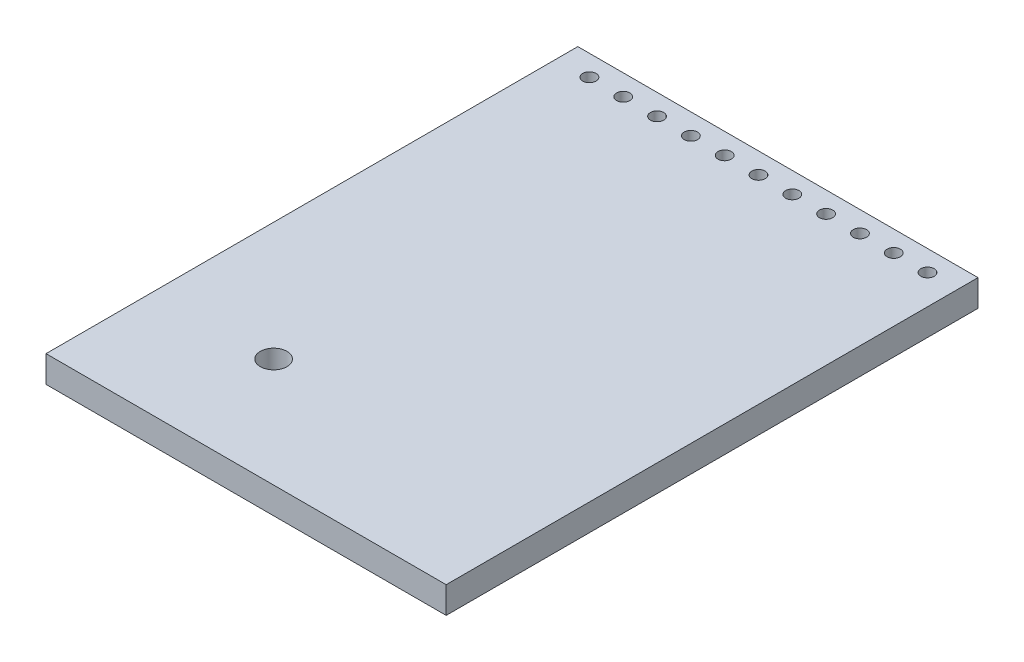
from build123d import *

# Parameters (mm, degrees)
SKETCH1_W           = 30.06
SKETCH1_H           = 2
BOSS_EXTRUDE1_DEPTH = 39.95
SKETCH2_R           = 1
CUT_EXTRUDE1_DEPTH  = 39.95
SKETCH3_R           = 0.5
CUT_EXTRUDE2_DEPTH  = 4.5
LPATTERN1_COUNT     = 11
LPATTERN1_PITCH     = 2.54
SKETCH4_W           = 1.3
SKETCH4_H           = 2
BOSS_EXTRUDE2_DEPTH = 0.2
SKETCH5_W           = 1
SKETCH5_H           = 1
BOSS_EXTRUDE3_DEPTH = 0.2


with BuildPart() as part:
    # Sketch1 → Boss-Extrude1 (new body)
    with BuildSketch(Plane.XY):
        with Locations((15.03, 1)):
            Rectangle(SKETCH1_W, SKETCH1_H)
    extrude(amount=BOSS_EXTRUDE1_DEPTH)

    # Sketch2 → Cut-Extrude1 (cut)
    with BuildSketch(Plane(origin=(0, 2, 0), x_dir=(1, 0, 0), z_dir=(0, 1, 0))):
        with Locations(Location((8.9, -31.75, 0), (0, 0, 270))):
            Circle(SKETCH2_R)
    extrude(amount=-CUT_EXTRUDE1_DEPTH, mode=Mode.SUBTRACT)

    # Sketch3 → Cut-Extrude2 (cut)
    with BuildSketch(Plane(origin=(0, 2, 0), x_dir=(1, 0, 0), z_dir=(0, 1, 0))):
        with Locations(Location((27.83, -1.56, 0), (0, 0, 270))):
            Circle(SKETCH3_R)
    cut_extrude2 = extrude(amount=-CUT_EXTRUDE2_DEPTH, mode=Mode.SUBTRACT)

    # LPattern1: Cut-Extrude2 ×11
    with Locations(*[(-i * LPATTERN1_PITCH, 0, 0) for i in range(1, LPATTERN1_COUNT)]):
        add(cut_extrude2, mode=Mode.SUBTRACT)

    # Sketch4 → Boss-Extrude2 (add)
    with BuildSketch(Plane.XZ):
        with Locations((14.06, 36.2)):
            Rectangle(SKETCH4_W, SKETCH4_H)
    extrude(amount=BOSS_EXTRUDE2_DEPTH)

    # Sketch5 → Boss-Extrude3 (add)
    with BuildSketch(Plane.XZ):
        with Locations((4.26, 36.86)):
            Rectangle(SKETCH5_W, SKETCH5_H)
    extrude(amount=BOSS_EXTRUDE3_DEPTH)


solid = part.part
